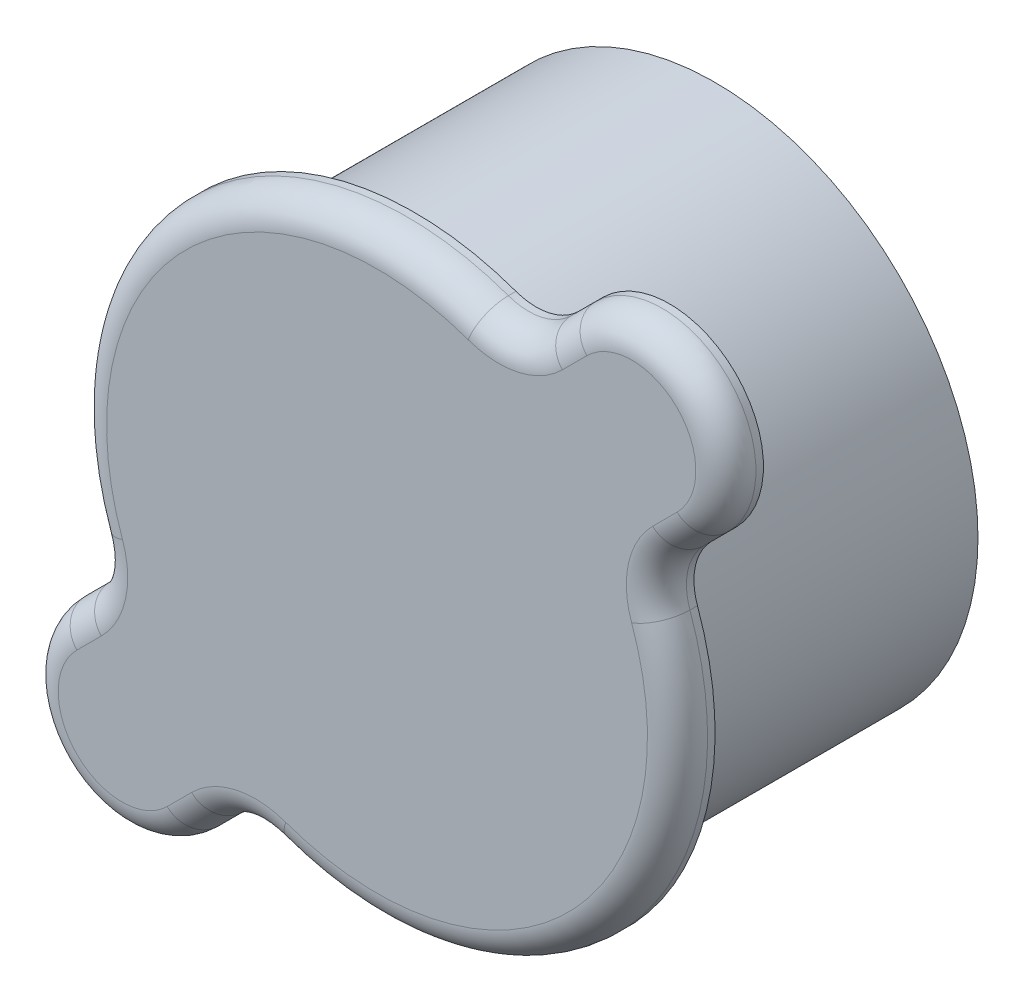
from build123d import *

# Parameters (mm, degrees)
SKETCH1_R           = 22.225
BOSS_EXTRUDE1_DEPTH = 3.175
FILLET1_R           = 2.54
SKETCH1_3_R         = 22.225
BOSS_EXTRUDE2_DEPTH = 25.4


with BuildPart() as part:
    # Sketch1 → Boss-Extrude1 (new body)
    # profile 1 of 2: a face of its own
    with BuildSketch(Plane.XY):
        with BuildLine():
            Line((25.100798696, 13.875478544), (27.165274766, 15.939954615))
            ThreePointArc((27.165274766, 15.939954615), (27.165274766, 27.165274766), (15.939954615, 27.165274766))
            Line((15.939954615, 27.165274766), (13.875478544, 25.100798696))
            ThreePointArc((13.875478544, 25.100798696), (11.395117189, 23.736044101), (8.56948008, 23.910750953))
            ThreePointArc((8.56948008, 23.910750953), (-17.960512242, 17.960512242), (-23.910750953, -8.56948008))
            ThreePointArc((-23.910750953, -8.56948008), (-23.736044101, -11.395117189), (-25.100798696, -13.875478544))
            Line((-25.100798696, -13.875478544), (-27.165274766, -15.939954615))
            ThreePointArc((-27.165274766, -15.939954615), (-27.165274766, -27.165274766), (-15.939954615, -27.165274766))
            Line((-15.939954615, -27.165274766), (-13.875478544, -25.100798696))
            ThreePointArc((-13.875478544, -25.100798696), (-11.395117189, -23.736044101), (-8.56948008, -23.910750953))
            ThreePointArc((-8.56948008, -23.910750953), (17.960512242, -17.960512242), (23.910750953, 8.56948008))
            ThreePointArc((23.910750953, 8.56948008), (23.736044101, 11.395117189), (25.100798696, 13.875478544))
        make_face()
        Circle(SKETCH1_R, mode=Mode.SUBTRACT)
    # profile 2 of 2: a face of its own
    with BuildSketch(Plane.XY):
        Circle(SKETCH1_R)
    extrude(amount=BOSS_EXTRUDE1_DEPTH)

    # Fillet1
    fillet1_edges = [part.edges().sort_by_distance(p)[0] for p in [
        (27.165274766, 27.165274766, 3.175),
        (14.90771658, 26.133036731, 3.175),
        (11.395117189, 23.736044101, 3.175),
        (-17.960512242, 17.960512242, 3.175),
        (-23.736044101, -11.395117189, 3.175),
        (-26.133036731, -14.90771658, 3.175),
        (-27.165274766, -27.165274766, 3.175),
        (-14.90771658, -26.133036731, 3.175),
        (26.133036731, 14.90771658, 3.175),
        (-11.395117189, -23.736044101, 3.175),
        (17.960512242, -17.960512242, 3.175),
        (23.736044101, 11.395117189, 3.175),
    ]]
    fillet(fillet1_edges, radius=FILLET1_R)

    # Sketch1<3> → Boss-Extrude2 (add)
    with BuildSketch(Plane.XY):
        Circle(SKETCH1_3_R)
    extrude(amount=-BOSS_EXTRUDE2_DEPTH)


solid = part.part
